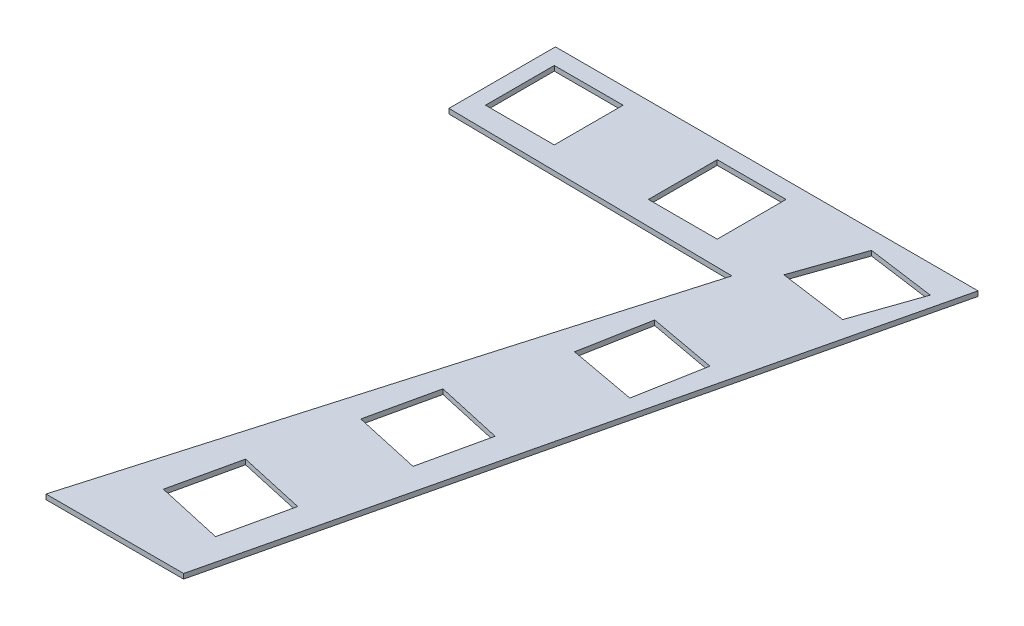
from build123d import *

# Parameters (mm, degrees)
BOSS_EXTRUDE1_DEPTH = 1
SKETCH2_W           = 14
SKETCH2_H           = 14
CUT_EXTRUDE1_DEPTH  = 112.007775968
CUT_EXTRUDE2_DEPTH  = 112.007775968


with BuildPart() as part:
    # Sketch1 → Boss-Extrude1 (new body)
    with BuildSketch(Plane(origin=(0, 0, 0), x_dir=(1, 0, 0), z_dir=(0, 1, 0))):
        Polygon((-16.174938897, 86.307472271), (69.805061103, 86.307472271), (38.792758309, -44.321715415), (10.792758309, -44.321715415), (42.145061103, 63.898255059), (-16.174938897, 64.637472271), align=None)
    extrude(amount=BOSS_EXTRUDE1_DEPTH)

    # Sketch2 → Cut-Extrude1 (cut, through all)
    with BuildSketch(Plane(origin=(0, 0, 0), x_dir=(1, 0, 0), z_dir=(0, 1, 0))):
        with Locations((-6.014238297, 75.907608588)):
            Rectangle(SKETCH2_W, SKETCH2_H)
        with Locations((27.168678058, 75.880355848)):
            Rectangle(SKETCH2_W, SKETCH2_H)
        Polygon((47.235283442, 69.379844428), (61.104296679, 67.469223626), (65.705307468, 80.691579684), (51.836294232, 82.602200486), align=None)
    extrude(amount=CUT_EXTRUDE1_DEPTH, mode=Mode.SUBTRACT)

    # Sketch3 → Cut-Extrude2 (cut, through all)
    with BuildSketch(Plane(origin=(0, 1, 0), x_dir=(1, 0, 0), z_dir=(0, 1, 0))):
        Polygon((42.039756476, 48.29086531), (55.808834799, 45.758577387), (53.276546876, 31.989499063), (39.507468553, 34.521786986), align=None)
        Polygon((46.302698973, 11.55658303), (43.259967448, -2.108766759), (29.594617659, 0.933964766), (32.637349184, 14.599314555), align=None)
        Polygon((38.601429809, -20.915974937), (35.546831549, -34.578677066), (21.88412942, -31.524078805), (24.93872768, -17.861376676), align=None)
    extrude(amount=-CUT_EXTRUDE2_DEPTH, mode=Mode.SUBTRACT)


solid = part.part
